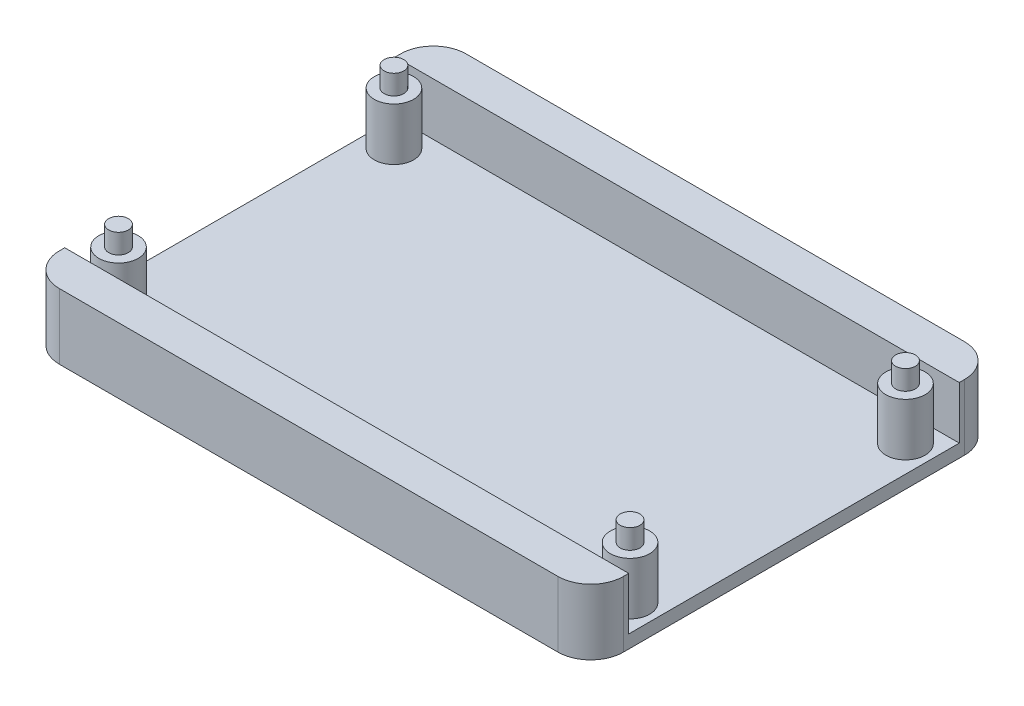
from build123d import *

# Parameters (mm, degrees)
SKETCH_1_W          = 86
SKETCH_1_H          = 62
EXTRUDE_1_DEPTH     = 10
SKETCH_2_W          = 86
SKETCH_2_H          = 50.4
SKETCH_2_R          = 3
CUT_EXTRUDE_1_DEPTH = 8
SKETCH_3_R          = 1.5
EXTRUDE_2_DEPTH     = 3
FILLET_1_R          = 5


with BuildPart() as part:
    # 草图1 → 凸台-拉伸1 (new body)
    with BuildSketch(Plane(origin=(0, 0, 0), x_dir=(1, 0, 0), z_dir=(0, 1, 0))):
        Rectangle(SKETCH_1_W, SKETCH_1_H)
    extrude(amount=EXTRUDE_1_DEPTH)

    # 草图2 → 切除-拉伸1 (cut)
    with BuildSketch(Plane(origin=(0, 10, 0), x_dir=(1, 0, 0), z_dir=(0, 1, 0))):
        Rectangle(SKETCH_2_W, SKETCH_2_H)
        with Locations(Location((-39, 21, 0), (0, 0, 270))):
            Circle(SKETCH_2_R, mode=Mode.SUBTRACT)
        with Locations(Location((39, 21, 0), (0, 0, 270))):
            Circle(SKETCH_2_R, mode=Mode.SUBTRACT)
        with Locations(Location((39, -21, 0), (0, 0, 270))):
            Circle(SKETCH_2_R, mode=Mode.SUBTRACT)
        with Locations(Location((-39, -21, 0), (0, 0, 270))):
            Circle(SKETCH_2_R, mode=Mode.SUBTRACT)
    extrude(amount=-CUT_EXTRUDE_1_DEPTH, mode=Mode.SUBTRACT)

    # 草图3 → 凸台-拉伸2 (add)
    with BuildSketch(Plane(origin=(0, 10, 0), x_dir=(1, 0, 0), z_dir=(0, 1, 0))):
        with Locations(Location((-39, 21, 0), (0, 0, 270))):
            Circle(SKETCH_3_R)
        with Locations(Location((39, 21, 0), (0, 0, 270))):
            Circle(SKETCH_3_R)
        with Locations(Location((39, -21, 0), (0, 0, 270))):
            Circle(SKETCH_3_R)
        with Locations(Location((-39, -21, 0), (0, 0, 270))):
            Circle(SKETCH_3_R)
    extrude(amount=EXTRUDE_2_DEPTH)

    # 圆角1
    fillet_1_edges = [part.edges().sort_by_distance(p)[0] for p in [
        (-43, 5, -31),
        (43, 5, -31),
        (43, 5, 31),
        (-43, 5, 31),
    ]]
    fillet(fillet_1_edges, radius=FILLET_1_R)


solid = part.part
